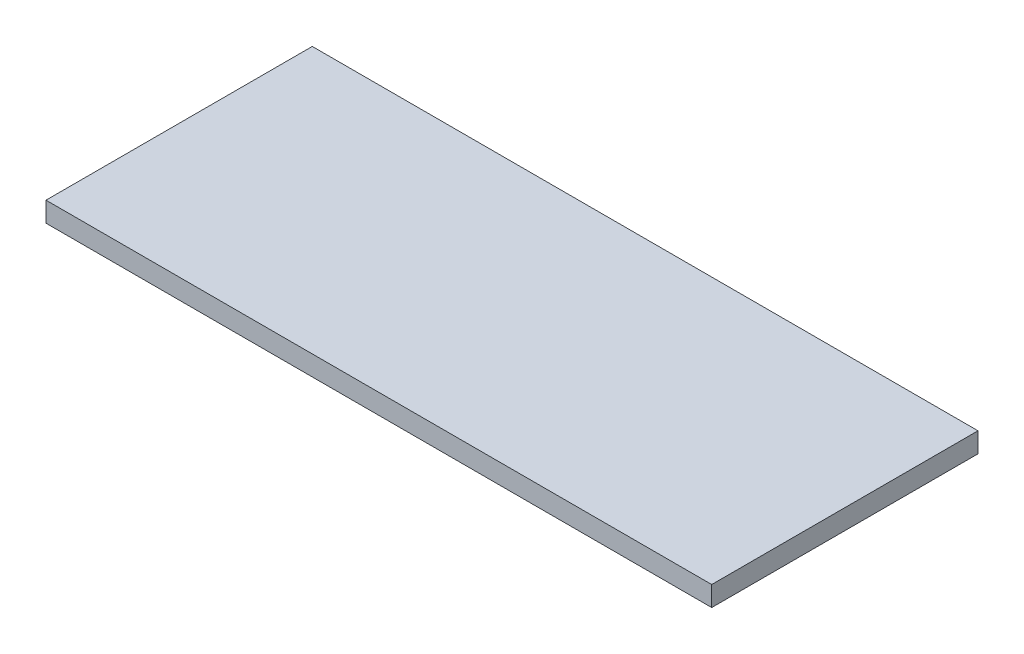
from build123d import *

# Parameters (mm, degrees)
SKETCH_1_W      = 500
SKETCH_1_H      = 200
EXTRUDE_1_DEPTH = 15


with BuildPart() as part:
    # Эскиз1 → Бобышка-Вытянуть1 (new body)
    with BuildSketch(Plane(origin=(0, 0, 0), x_dir=(1, 0, 0), z_dir=(0, 1, 0))):
        Rectangle(SKETCH_1_W, SKETCH_1_H)
    extrude(amount=-EXTRUDE_1_DEPTH)


solid = part.part
